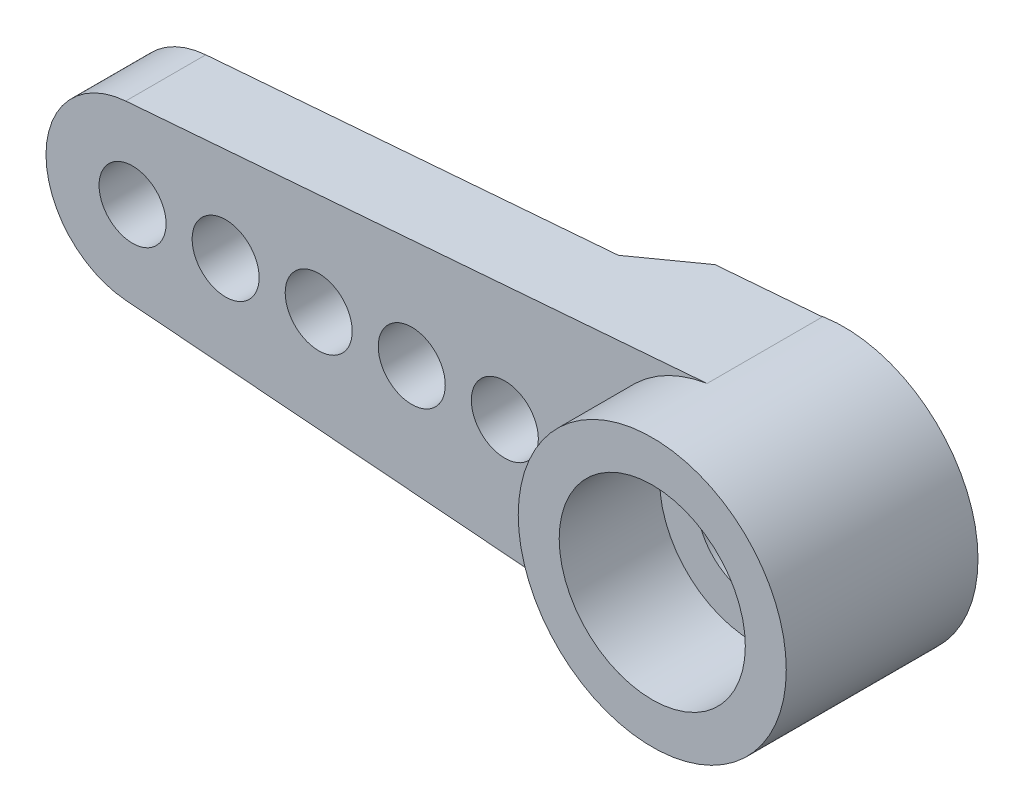
from build123d import *

# Parameters (mm, degrees)
RESSALTO_EXTRUS_O1_DEPTH      = 2.8
RESSALTO_EXTRUS_O1_DEPTH_BACK = 0.15
ESBO_O1_R                     = 3.6
ESBO_O1_R_2                   = 2.45
ESBO_O2_R                     = 2.5
ESBO_O2_R_2                   = 1
RESSALTO_EXTRUS_O2_DEPTH      = 0.5
ESBO_O3_R                     = 3.6
ESBO_O3_R_2                   = 2.45
RESSALTO_EXTRUS_O3_DEPTH      = 2.2
ESBO_O4_W                     = 22
ESBO_O4_H                     = 2.15
RESSALTO_EXTRUS_O4_DEPTH      = 3.6
CORTE_EXTRUS_O2_DEPTH         = 7.2
ESBO_O7_R                     = 2.5
CORTE_EXTRUS_O3_DEPTH         = 2.7
ESBO_O8_R                     = 1.5
ESBO_O8_R_2                   = 0.9
CORTE_EXTRUS_O4_DEPTH         = 6.9
RESSALTO_EXTRUS_O5_DEPTH      = 0.95
CORTE_EXTRUS_O5_DEPTH         = 12
CORTE_EXTRUS_O5_DEPTH_BACK    = 4.95


with BuildPart() as part:
    # Esboço1 → Ressalto-extrusão1 (new, two sides: drawn at the far end of the back side and taken through both)
    with BuildSketch(Plane.XY.offset(-RESSALTO_EXTRUS_O1_DEPTH_BACK)):
        Circle(ESBO_O1_R)
        Circle(ESBO_O1_R_2, mode=Mode.SUBTRACT)
    extrude(amount=RESSALTO_EXTRUS_O1_DEPTH + RESSALTO_EXTRUS_O1_DEPTH_BACK)



with BuildPart() as body_2:
    # Esboço2 → Ressalto-extrusão2 (new body)
    with BuildSketch(Plane(origin=(0, 0, -0.15), x_dir=(-1, 0, 0), z_dir=(0, 0, -1))):
        Circle(ESBO_O2_R)
        Circle(ESBO_O2_R_2, mode=Mode.SUBTRACT)
    extrude(amount=RESSALTO_EXTRUS_O2_DEPTH)


with BuildPart() as part_1:
    add(part.part)

    add(body_2.part)  # Ressalto-extrusão3 merges body 2
    # Esboço3 → Ressalto-extrusão3 (add)
    with BuildSketch(Plane(origin=(0, 0, -0.15), x_dir=(-1, 0, 0), z_dir=(0, 0, -1))):
        with Locations(Location((0, 0, 0), (0, 0, 180))):
            Circle(ESBO_O3_R)
        with Locations(Location((0, 0, 0), (0, 0, 180))):
            Circle(ESBO_O3_R_2, mode=Mode.SUBTRACT)
    extrude(amount=RESSALTO_EXTRUS_O3_DEPTH)

    # Esboço4 → Ressalto-extrusão4 (add, symmetric)
    with BuildSketch(Plane(origin=(0, 0, 0), x_dir=(1, 0, 0), z_dir=(0, 1, 0))):
        with Locations((-7.325, 0.315)):
            Rectangle(ESBO_O4_W, ESBO_O4_H)
    extrude(amount=RESSALTO_EXTRUS_O4_DEPTH, both=True)

    # Esboço5 → Corte-extrusão2 (cut)
    with BuildSketch(Plane.XY.offset(0.76)):
        with BuildLine():
            ThreePointArc((0, -3.6), (-0.28434443, -3.588753021), (-0.566912184, -3.555082358))
            Line((-0.566912184, -3.555082358), (-16.183639111, -2.317736326))
            ThreePointArc((-16.183639111, -2.317736326), (-17.70771571, -1.577761723), (-18.325, -1.7e-08))
            Line((-18.325, -1.7e-08), (-18.325, -3.6))
            Line((-18.325, -3.6), (0, -3.6))
        make_face()
        with BuildLine():
            ThreePointArc((0, 3.6), (3.6, 0), (0, -3.6))
            Line((0, -3.6), (3.675, -3.6))
            Line((3.675, -3.6), (3.675, 3.6))
            Line((3.675, 3.6), (0, 3.6))
        make_face()
        with BuildLine():
            Line((-16.183639111, 2.317736326), (-0.566912184, 3.555082358))
            ThreePointArc((-0.566912184, 3.555082358), (-0.28434443, 3.588753021), (0, 3.6))
            Line((0, 3.6), (-18.325, 3.6))
            Line((-18.325, 3.6), (-18.325, -1.7e-08))
            ThreePointArc((-18.325, -1.7e-08), (-17.707715722, 1.57776171), (-16.183639111, 2.317736326))
        make_face()
    extrude(amount=-CORTE_EXTRUS_O2_DEPTH, mode=Mode.SUBTRACT)

    # Esboço7 → Corte-extrusão3 (cut)
    with BuildSketch(Plane.XY.offset(2.8)):
        Circle(ESBO_O7_R)
    extrude(amount=-CORTE_EXTRUS_O3_DEPTH, mode=Mode.SUBTRACT)

    # Esboço8 → Corte-extrusão4 (cut, symmetric)
    with BuildSketch(Plane.XY.offset(0.1)):
        Circle(ESBO_O8_R)
        with Locations((-6, 0)):
            Circle(ESBO_O8_R_2)
        with Locations((-8.5, 0)):
            Circle(ESBO_O8_R_2)
        with Locations((-11, 0)):
            Circle(ESBO_O8_R_2)
        with Locations((-13.5, 0)):
            Circle(ESBO_O8_R_2)
        with Locations((-16, 0)):
            Circle(ESBO_O8_R_2)
    extrude(amount=CORTE_EXTRUS_O4_DEPTH, both=True, mode=Mode.SUBTRACT)

    # Esboço10 → Ressalto-extrusão5 (add)
    with BuildSketch(Plane(origin=(0, 0, -1.39), x_dir=(-1, 0, 0), z_dir=(0, 0, -1))):
        with BuildLine():
            Line((0.566912184, -3.555082358), (5.1, -3.195916302))
            Line((5.1, -3.195916302), (5.1, -2.395916302))
            Line((5.1, -2.395916302), (2.686928558, -2.395916302))
            ThreePointArc((2.686928558, -2.395916302), (1.727074515, -3.158672763), (0.566912184, -3.555082358))
        make_face()
        with BuildLine():
            ThreePointArc((3.577708764, 0.4), (3.6, 0), (3.577708764, -0.4))
            Line((3.577708764, -0.4), (5.193774225, -0.4))
            ThreePointArc((5.193774225, -0.4), (5.1, 0), (5.193774225, 0.4))
            Line((5.193774225, 0.4), (3.577708764, 0.4))
        make_face()
        with BuildLine():
            ThreePointArc((0.566912184, 3.555082358), (1.727074515, 3.158672763), (2.686928558, 2.395916302))
            Line((2.686928558, 2.395916302), (5.1, 2.395916302))
            Line((5.1, 2.395916302), (5.1, 3.195916302))
            Line((5.1, 3.195916302), (0.566912184, 3.555082358))
        make_face()
    extrude(amount=RESSALTO_EXTRUS_O5_DEPTH)

    # Esboço11 → Corte-extrusão5 (cut, two sides: drawn at the far end of the back side and taken through both)
    with BuildSketch(Plane(origin=(0, 0, 0), x_dir=(1, 0, 0), z_dir=(0, 1, 0)).offset(-CORTE_EXTRUS_O5_DEPTH_BACK)):
        Polygon((-5.1, 1.39), (-2.045555334, 3.15348445), (-5.859008957, 3.15348445), (-5.859008957, 1.39), align=None)
    extrude(amount=CORTE_EXTRUS_O5_DEPTH + CORTE_EXTRUS_O5_DEPTH_BACK, mode=Mode.SUBTRACT)


solid = part_1.part
